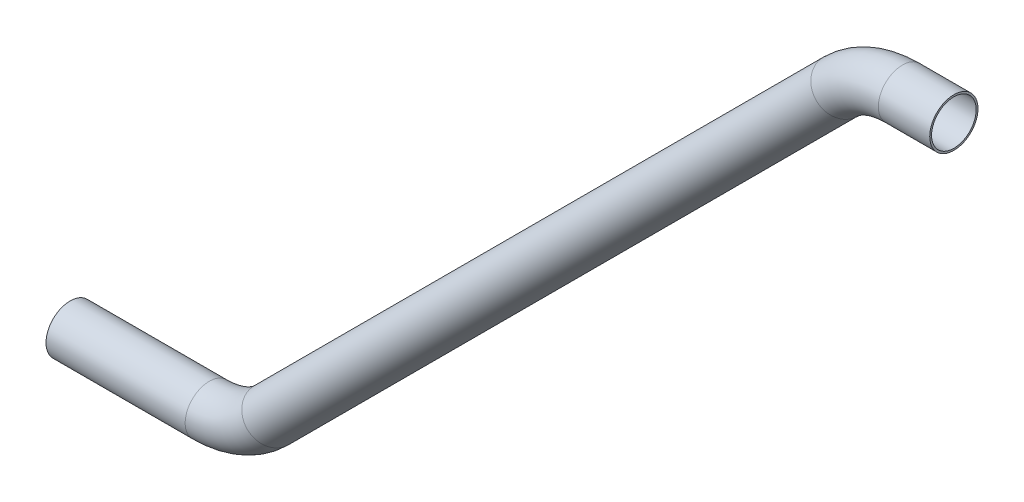
from build123d import *

# Parameters (mm, degrees)
BARRER2_PROFILE_R = 41.275
VACIADO1_T        = -3.175


with BuildPart() as part:
    # Barrer2: sweep along a path in Croquis1
    with BuildLine(Plane.XY) as barrer2_path:
        Line((0, 0), (237.867965644, 0))
        ThreePointArc((237.867965644, 0), (295.270480499, 11.418070123), (343.933982822, 43.933982822))
        Line((343.933982822, 43.933982822), (1316.726188958, 1016.726188958))
        ThreePointArc((1316.726188958, 1016.726188958), (1365.389691281, 1049.242101657), (1422.792206136, 1060.66017178))
        Line((1422.792206136, 1060.66017178), (1510.66017178, 1060.66017178))
    # Barrer2 profile (on start of the path) → Barrer2 (sweep)
    with BuildSketch(Plane.YZ):
        Circle(BARRER2_PROFILE_R)
    sweep(path=barrer2_path.line)

    # Vaciado1
    vaciado1_openings = [part.faces().sort_by_distance(p)[0] for p in [
        (1510.66017178, 1060.66017178, 0),
    ]]
    offset(amount=VACIADO1_T, openings=vaciado1_openings, kind=Kind.INTERSECTION)


solid = part.part
